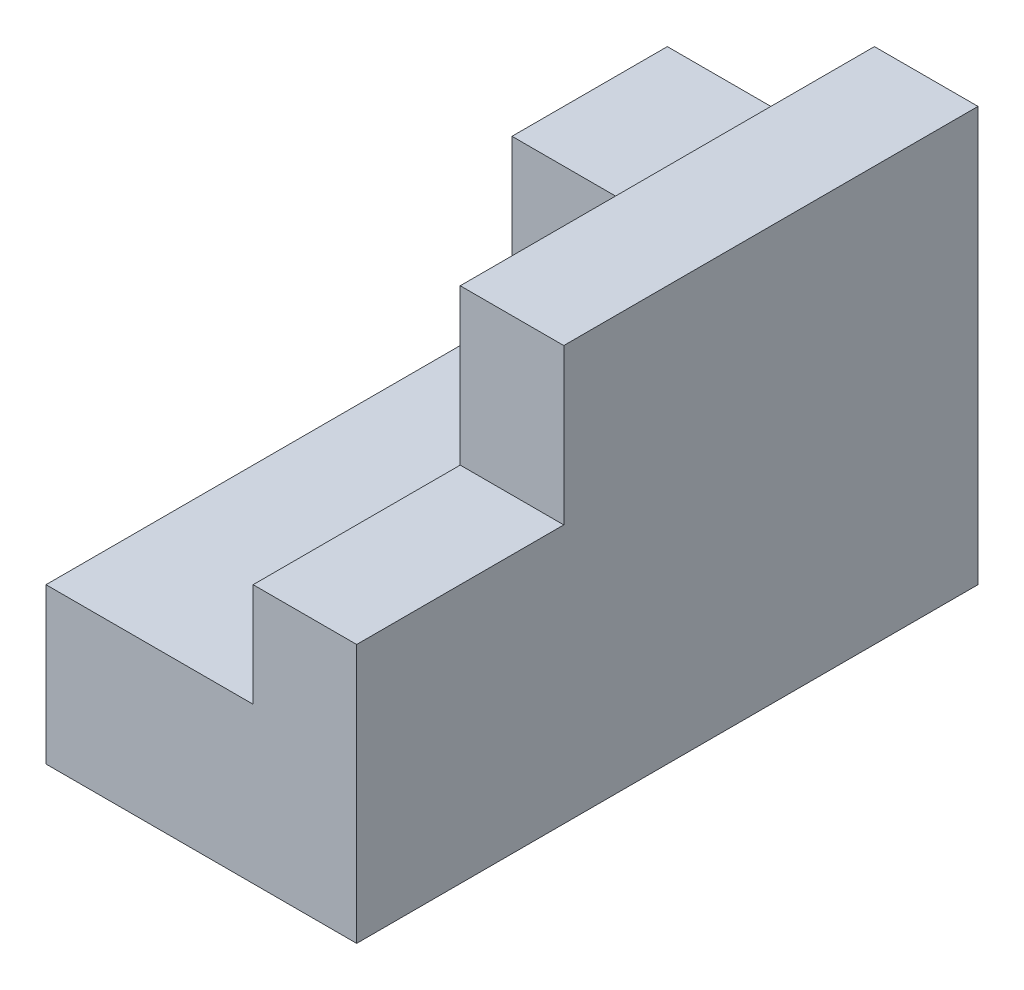
from build123d import *

# Parameters (mm, degrees)
BOSS_EXTRUDE1_DEPTH = 15
BOSS_EXTRUDE2_DEPTH = 60
BOSS_EXTRUDE3_DEPTH = 40


with BuildPart() as part:
    # Sketch1 → Boss-Extrude1 (new body)
    with BuildSketch(Plane.XY):
        Polygon((-10, 30), (-30, 30), (-30, 15), (-10, 15), (-10, 25), align=None)
    extrude(amount=BOSS_EXTRUDE1_DEPTH)

    # Sketch1<3> → Boss-Extrude2 (add)
    with BuildSketch(Plane.XY):
        Polygon((-10, 15), (-30, 15), (-30, 0), (0, 0), (0, 25), (-10, 25), align=None)
    extrude(amount=BOSS_EXTRUDE2_DEPTH)

    # Sketch1<4> → Boss-Extrude3 (add)
    with BuildSketch(Plane.XY):
        Polygon((-10, 40), (-10, 30), (-10, 25), (0, 25), (0, 40), align=None)
    extrude(amount=BOSS_EXTRUDE3_DEPTH)


solid = part.part
